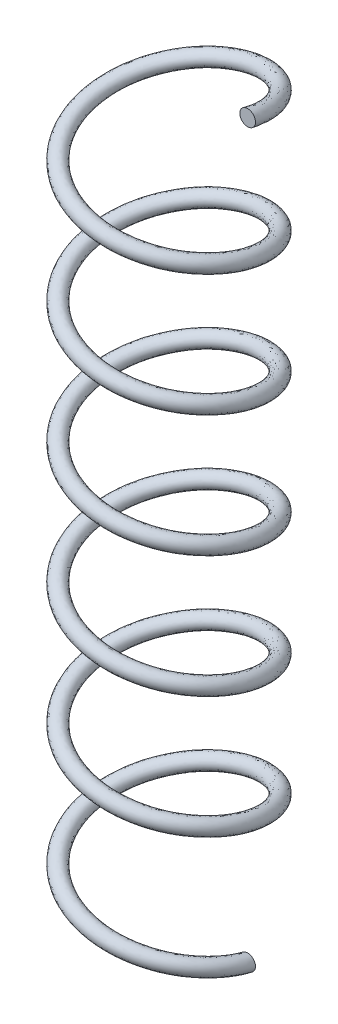
from build123d import *

# Parameters (mm, degrees)
SWEEP1_PITCH       = 3.1
SWEEP1_HEIGHT      = 18.6
SWEEP1_RADIUS      = 2
SWEEP1_START_ANGLE = 90
SKETCH4_R          = 0.2


with BuildPart() as part:
    # Sweep1: sweep along a helix
    with BuildLine() as sweep1_path:
        add(Helix(SWEEP1_PITCH, SWEEP1_HEIGHT, SWEEP1_RADIUS, center=(0, 0, 0), direction=(0, 1, 0), lefthand=True, mode=Mode.PRIVATE).rotate(Axis((0, 0, 0), (0, 1, 0)), SWEEP1_START_ANGLE))
    # Sketch4 → Sweep1 (sweep)
    with BuildSketch(Plane.XY):
        with Locations((2, 0)):
            Circle(SKETCH4_R)
    sweep(path=sweep1_path.line, is_frenet=True)


solid = part.part
